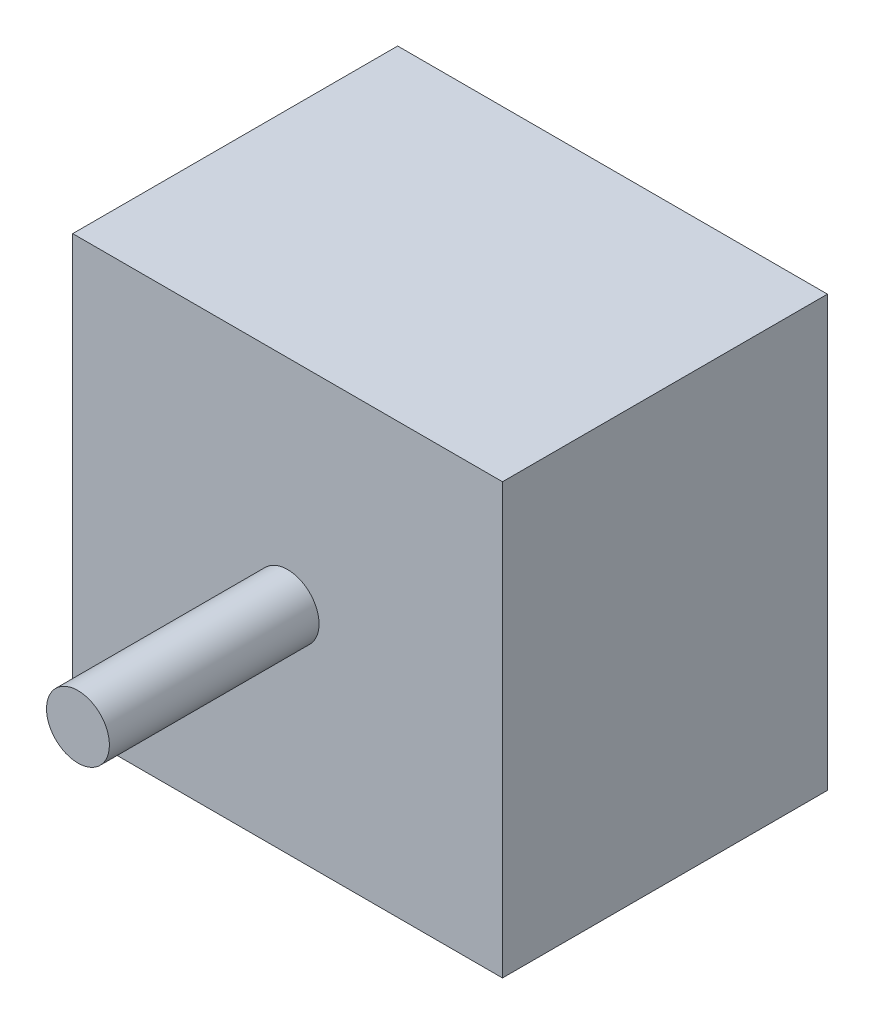
from build123d import *

# Parameters (mm, degrees)
SKETCH1_W           = 41
SKETCH1_H           = 41
SKETCH1_R           = 3
BOSS_EXTRUDE1_DEPTH = 31
SKETCH1_2_R         = 3
BOSS_EXTRUDE2_DEPTH = 51


with BuildPart() as part:
    # Sketch1 → Boss-Extrude1 (new body)
    with BuildSketch(Plane.XY):
        Rectangle(SKETCH1_W, SKETCH1_H)
        Circle(SKETCH1_R, mode=Mode.SUBTRACT)
    extrude(amount=BOSS_EXTRUDE1_DEPTH)

    # Sketch1<2> → Boss-Extrude2 (add)
    with BuildSketch(Plane.XY):
        Circle(SKETCH1_2_R)
    extrude(amount=BOSS_EXTRUDE2_DEPTH)


solid = part.part
